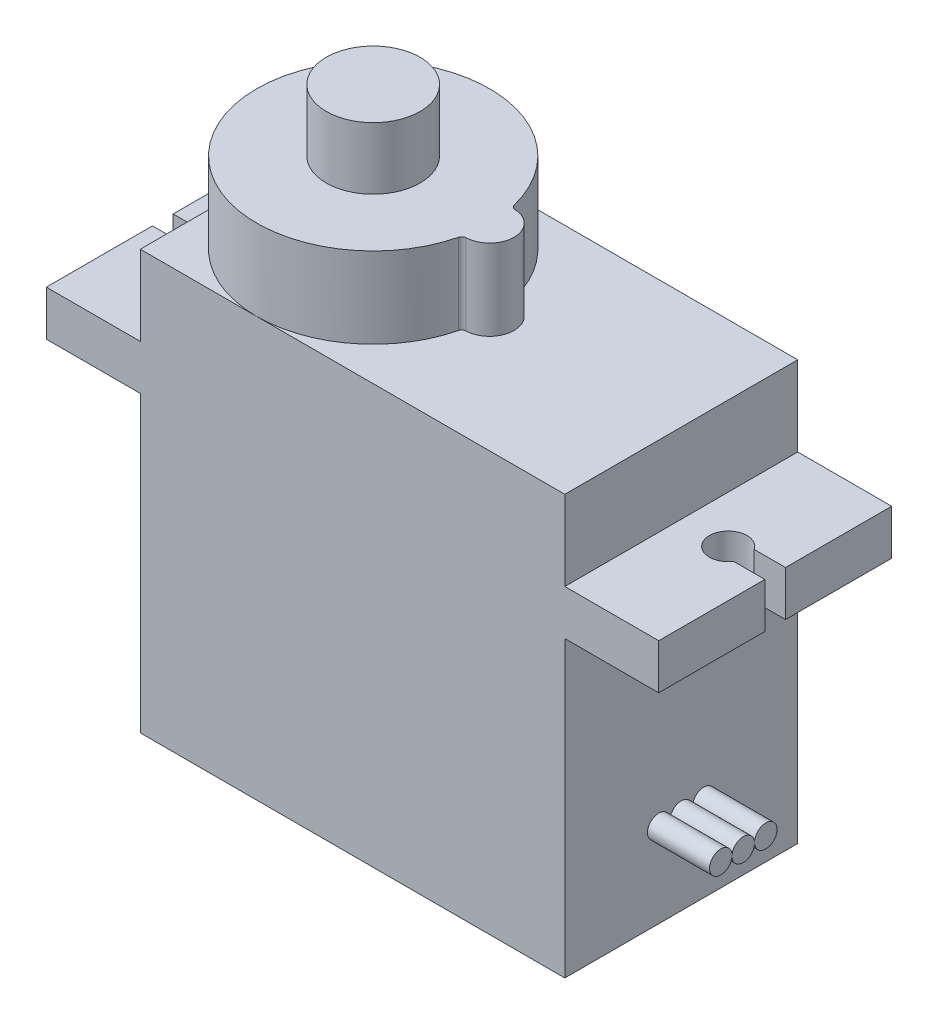
from build123d import *

# Parameters (mm, degrees)
SKETCH1_W             = 22.6
SKETCH1_H             = 12.4
BOSS_EXTRUDE1_DEPTH   = 22.3
SKETCH2_W             = 5
SKETCH2_H             = 2.4
BOSS_EXTRUDE2_DEPTH   = 12.4
CUT_EXTRUDE1_DEPTH    = 26.098456128
BOSS_EXTRUDE3_DEPTH   = 4.3
SKETCH5_R             = 2.5
BOSS_EXTRUDE4_DEPTH   = 3.3
SKETCH6_R             = 0.6
BOSS_EXTRUDE7_DEPTH   = 3.3
BOSS_EXTRUDE7_2_DEPTH = 3.3
BOSS_EXTRUDE7_3_DEPTH = 3.3


with BuildPart() as part:
    # Sketch1 → Boss-Extrude1 (new body)
    with BuildSketch(Plane(origin=(0, 0, 0), x_dir=(1, 0, 0), z_dir=(0, 1, 0))):
        Rectangle(SKETCH1_W, SKETCH1_H)
    extrude(amount=BOSS_EXTRUDE1_DEPTH)

    # Sketch2 → Boss-Extrude2 (add)
    with BuildSketch(Plane.XY.offset(6.2)):
        with Locations((13.8, 16.85)):
            Rectangle(SKETCH2_W, SKETCH2_H)
        with Locations((-13.8, 16.85)):
            Rectangle(SKETCH2_W, SKETCH2_H)
    extrude(amount=-BOSS_EXTRUDE2_DEPTH)

    # Sketch3 → Cut-Extrude1 (cut, through all)
    with BuildSketch(Plane(origin=(0, 18.05, 0), x_dir=(1, 0, 0), z_dir=(0, 1, 0))):
        with BuildLine():
            Line((14.635164654, 0.55), (16.3, 0.55))
            Line((16.3, 0.55), (16.3, -0.55))
            Line((16.3, -0.55), (14.635164654, -0.55))
            ThreePointArc((14.635164654, -0.55), (12.8, 0), (14.635164654, 0.55))
        make_face()
        with BuildLine():
            Line((-16.3, -0.55), (-14.635164654, -0.55))
            ThreePointArc((-14.635164654, -0.55), (-12.8, 0), (-14.635164654, 0.55))
            Line((-14.635164654, 0.55), (-16.3, 0.55))
            Line((-16.3, 0.55), (-16.3, -0.55))
        make_face()
    extrude(amount=-CUT_EXTRUDE1_DEPTH, mode=Mode.SUBTRACT)

    # Sketch4 → Boss-Extrude3 (add)
    with BuildSketch(Plane(origin=(0, 22.3, 0), x_dir=(1, 0, 0), z_dir=(0, 1, 0))):
        with BuildLine():
            ThreePointArc((0.918604651, 1.488757218), (-11.3, 0), (0.918604651, -1.488757218))
            ThreePointArc((0.918604651, -1.488757218), (1.003329596, -1.355013632), (1.151404787, -1.298983275))
            ThreePointArc((1.151404787, -1.298983275), (2.4, 0), (1.151404787, 1.298983275))
            ThreePointArc((1.151404787, 1.298983275), (1.003329596, 1.355013632), (0.918604651, 1.488757218))
        make_face()
    extrude(amount=BOSS_EXTRUDE3_DEPTH)

    # Sketch5 → Boss-Extrude4 (add)
    with BuildSketch(Plane(origin=(0, 26.6, 0), x_dir=(1, 0, 0), z_dir=(0, 1, 0))):
        with Locations(Location((-5.1, 0, 0), (0, 0, 270))):
            Circle(SKETCH5_R)
    extrude(amount=BOSS_EXTRUDE4_DEPTH)


with BuildPart() as body_2:
    # Sketch6 → Boss-Extrude7 (new body)
    with BuildSketch(Plane(origin=(11.3, 0, 0), x_dir=(0, 0, -1), z_dir=(1, 0, 0))):
        with Locations((0, 4.4687813)):
            Circle(SKETCH6_R)
    extrude(amount=BOSS_EXTRUDE7_DEPTH)


with BuildPart() as body_3:
    # Sketch6 → Boss-Extrude7 2 (new body)
    with BuildSketch(Plane(origin=(11.3, 0, 0), x_dir=(0, 0, -1), z_dir=(1, 0, 0))):
        with Locations((1.199593845, 4.5)):
            Circle(SKETCH6_R)
    extrude(amount=BOSS_EXTRUDE7_2_DEPTH)


with BuildPart() as body_4:
    # Sketch6 → Boss-Extrude7 3 (new body)
    with BuildSketch(Plane(origin=(11.3, 0, 0), x_dir=(0, 0, -1), z_dir=(1, 0, 0))):
        with Locations((-1.199593845, 4.5)):
            Circle(SKETCH6_R)
    extrude(amount=BOSS_EXTRUDE7_3_DEPTH)


solid = Compound([part.part, body_2.part, body_3.part, body_4.part])
